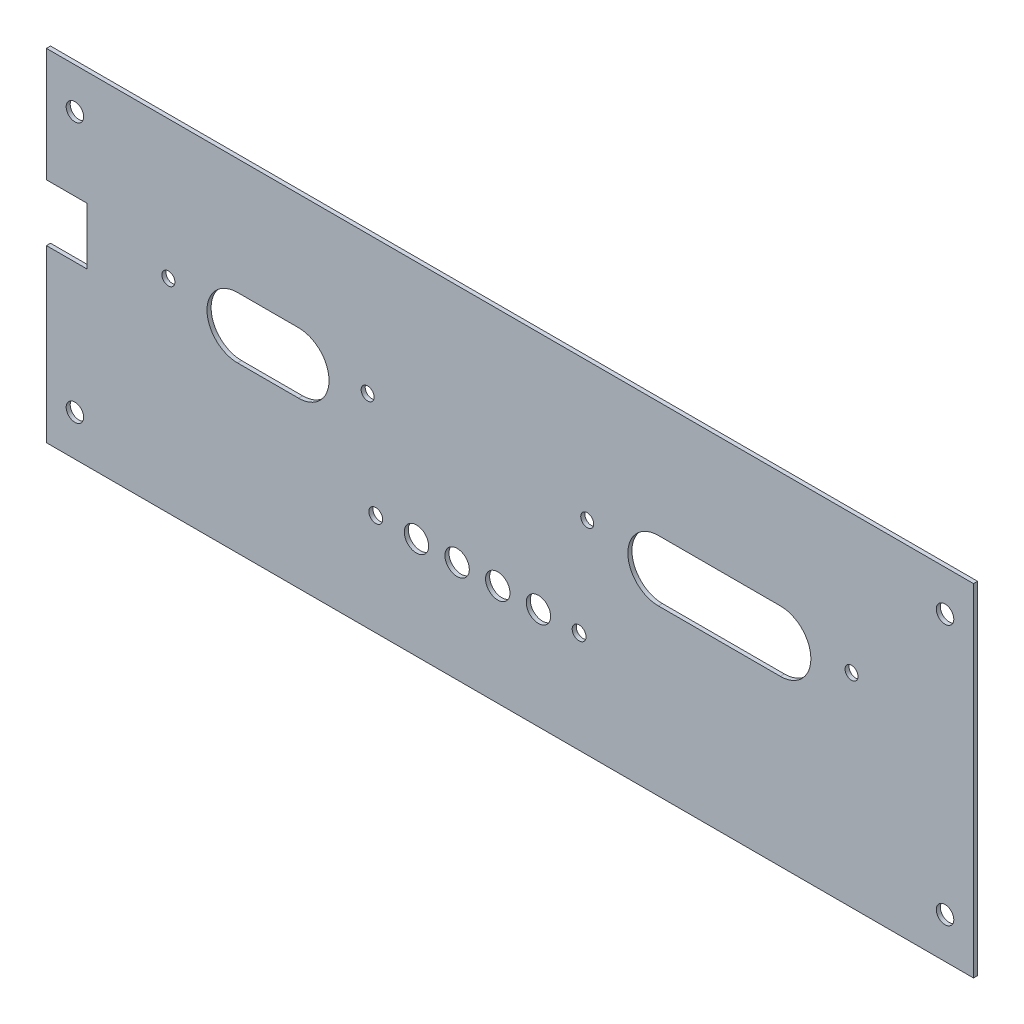
from build123d import *

# Parameters (mm, degrees)
SKETCH_1_W          = 228
SKETCH_1_H          = 84
SKETCH_1_R          = 2.15
EXTRUDE_1_DEPTH     = 1
SKETCH_4_R          = 1.6
SKETCH_4_W          = 14.464145402
SKETCH_4_H          = 14
CUT_EXTRUDE_2_DEPTH = 1
SKETCH_5_R          = 1.7
SKETCH_5_R_2        = 3
CUT_EXTRUDE_3_DEPTH = 10


with BuildPart() as part:
    # Эскиз1 → Вытянуть1 (new body)
    with BuildSketch(Plane.XY):
        Rectangle(SKETCH_1_W, SKETCH_1_H)
        with Locations((107, 32)):
            Circle(SKETCH_1_R, mode=Mode.SUBTRACT)
        with Locations(Location((-107, 32, 0), (0, 0, 180))):
            Circle(SKETCH_1_R, mode=Mode.SUBTRACT)
        with Locations((-107, -32)):
            Circle(SKETCH_1_R, mode=Mode.SUBTRACT)
        with Locations(Location((107, -32, 0), (0, 0, 180))):
            Circle(SKETCH_1_R, mode=Mode.SUBTRACT)
    extrude(amount=EXTRUDE_1_DEPTH)

    # Эскиз4 → Вырез-Вытянуть2 (cut)
    with BuildSketch(Plane.XY.offset(1)):
        with Locations((19, 8)):
            Circle(SKETCH_4_R)
        with Locations((84, 8)):
            Circle(SKETCH_4_R)
        with Locations((-84, 8)):
            Circle(SKETCH_4_R)
        with Locations((-35, 8)):
            Circle(SKETCH_4_R)
        with BuildLine():
            Line((36.5, 13.5), (66.5, 13.5))
            ThreePointArc((66.5, 13.5), (74, 6), (66.5, -1.5))
            Line((66.5, -1.5), (36.5, -1.5))
            ThreePointArc((36.5, -1.5), (29, 6), (36.5, 13.5))
        make_face()
        with BuildLine():
            Line((-67, 13.5), (-52, 13.5))
            ThreePointArc((-52, 13.5), (-44.5, 6), (-52, -1.5))
            Line((-52, -1.5), (-67, -1.5))
            ThreePointArc((-67, -1.5), (-74.5, 6), (-67, 13.5))
        make_face()
        with Locations((-111.232072701, 7)):
            Rectangle(SKETCH_4_W, SKETCH_4_H)
    extrude(amount=-CUT_EXTRUDE_2_DEPTH, mode=Mode.SUBTRACT)

    # Эскиз5 → Вырез-Вытянуть3 (cut)
    with BuildSketch(Plane.XY.offset(1)):
        with Locations((-33, -17)):
            Circle(SKETCH_5_R)
        with Locations((17, -17)):
            Circle(SKETCH_5_R)
        with Locations((7, -17)):
            Circle(SKETCH_5_R_2)
        with Locations((-3, -17)):
            Circle(SKETCH_5_R_2)
        with Locations((-13, -17)):
            Circle(SKETCH_5_R_2)
        with Locations((-23, -17)):
            Circle(SKETCH_5_R_2)
    extrude(amount=-CUT_EXTRUDE_3_DEPTH, mode=Mode.SUBTRACT)


solid = part.part
